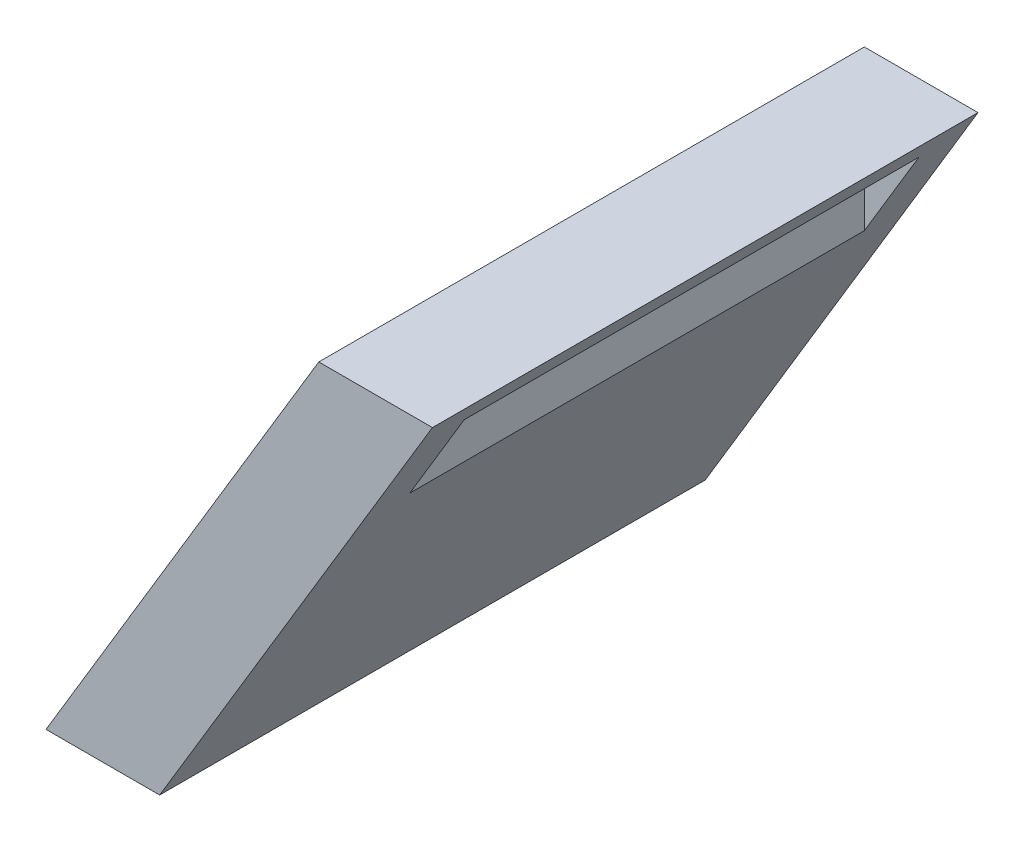
from build123d import *

# Parameters (mm, degrees)
EXTRUDE_1_DEPTH     = 48
CUT_EXTRUDE_START   = 2
SKETCH_2_W          = 14
SKETCH_2_H          = 40
CUT_EXTRUDE_1_DEPTH = 48
SKETCH_3_W          = 12
SKETCH_3_H          = 40
CUT_EXTRUDE_2_DEPTH = 38
SKETCH_4_R          = 1.8
CUT_EXTRUDE_3_DEPTH = 38


with BuildPart() as part:
    # 草图1 → 凸台-拉伸1 (new body)
    with BuildSketch(Plane.XY):
        Polygon((-24, 0), (-14, 0), (10, 40), (0, 40), align=None)
    extrude(amount=EXTRUDE_1_DEPTH)

    # 草图2 → 切除-拉伸1 (cut)
    with BuildSketch(Plane(origin=(0, 0, 0), x_dir=(1, 0, 0), z_dir=(0, 1, 0)).offset(CUT_EXTRUDE_START)):
        with Locations((-24, -24)):
            Rectangle(SKETCH_2_W, SKETCH_2_H)
    extrude(amount=CUT_EXTRUDE_1_DEPTH, mode=Mode.SUBTRACT)

    # 草图3 → 切除-拉伸2 (cut)
    with BuildSketch(Plane(origin=(0, 0, 0), x_dir=(1, 0, 0), z_dir=(0, 1, 0))):
        with Locations((10, -24)):
            Rectangle(SKETCH_3_W, SKETCH_3_H)
    extrude(amount=CUT_EXTRUDE_2_DEPTH, mode=Mode.SUBTRACT)

    # 草图4 → 切除-拉伸3 (cut)
    with BuildSketch(Plane(origin=(0, 2, 0), x_dir=(1, 0, 0), z_dir=(0, 1, 0))):
        with Locations(Location((-20.4, -9, 0), (0, 0, 270))):
            Circle(SKETCH_4_R)
        with Locations(Location((-20.4, -39, 0), (0, 0, 270))):
            Circle(SKETCH_4_R)
    extrude(amount=-CUT_EXTRUDE_3_DEPTH, mode=Mode.SUBTRACT)


solid = part.part
